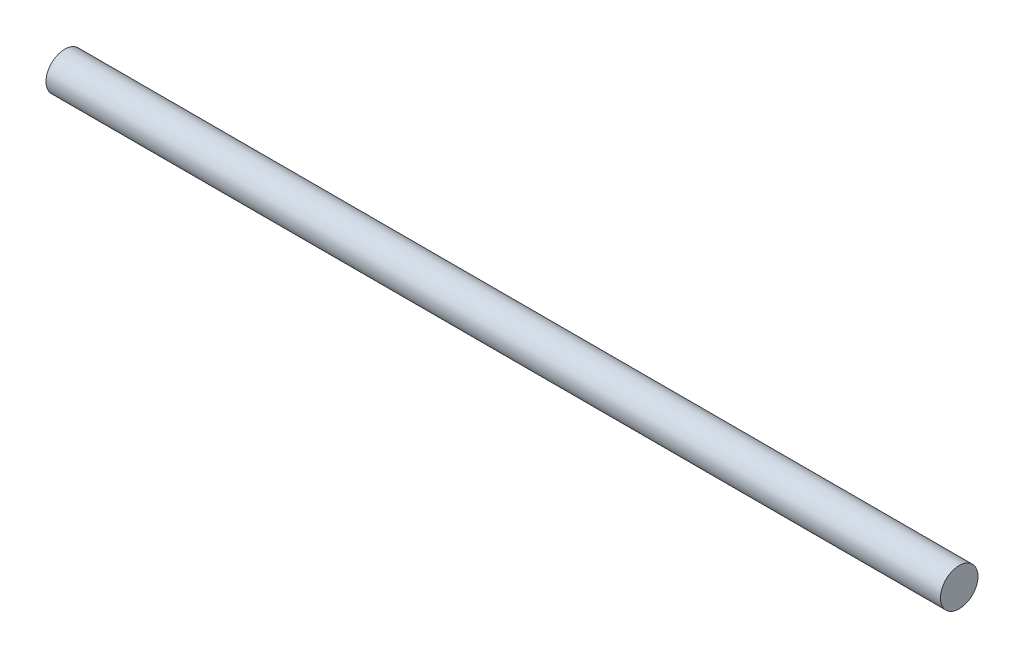
from build123d import *

# Parameters (mm, degrees)
SKETCH1_R           = 10
BOSS_EXTRUDE1_DEPTH = 590
SKETCH2_R           = 114
CUT_EXTRUDE1_DEPTH  = 114


with BuildPart() as part:
    # Sketch1 → Boss-Extrude1 (new body)
    with BuildSketch(Plane(origin=(0, 0, 0), x_dir=(0, 0, -1), z_dir=(1, 0, 0))):
        Circle(SKETCH1_R)
    extrude(amount=BOSS_EXTRUDE1_DEPTH)

    # Sketch2 → Cut-Extrude1 (cut)
    with BuildSketch(Plane.ZY):
        Circle(SKETCH2_R)
    extrude(amount=-CUT_EXTRUDE1_DEPTH, mode=Mode.SUBTRACT)


solid = part.part
